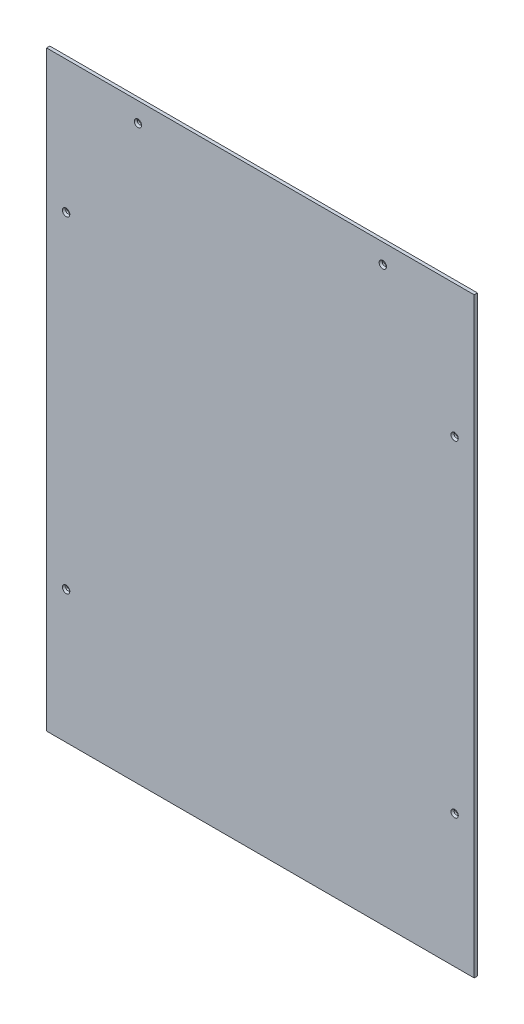
from build123d import *

# Parameters (mm, degrees)
ESQUISSE1_W             = 524
ESQUISSE1_H             = 725
BOSS_EXTRU_1_DEPTH      = 2
ESQUISSE2_R             = 2.5
ENL_V_MAT_EXTRU_1_DEPTH = 448.287659119
CHANFREIN1_SIZE         = 2


with BuildPart() as part:
    # Esquisse1 → Boss.-Extru.1 (new, symmetric)
    with BuildSketch(Plane.XY):
        Rectangle(ESQUISSE1_W, ESQUISSE1_H)
    extrude(amount=BOSS_EXTRU_1_DEPTH, both=True)

    # Esquisse2 → Enlèv. mat.-Extru.1 (cut, through all)
    with BuildSketch(Plane.XY.offset(2)):
        with Locations((-238, -200)):
            Circle(ESQUISSE2_R)
        with Locations((-238, 200)):
            Circle(ESQUISSE2_R)
        with Locations((238, -200)):
            Circle(ESQUISSE2_R)
        with Locations((238, 200)):
            Circle(ESQUISSE2_R)
        with Locations((-150, 338.5)):
            Circle(ESQUISSE2_R)
        with Locations((150, 338.5)):
            Circle(ESQUISSE2_R)
    extrude(amount=-ENL_V_MAT_EXTRU_1_DEPTH, mode=Mode.SUBTRACT)

    # Chanfrein1
    chanfrein1_edges = [part.edges().sort_by_distance(p)[0] for p in [
        (-152.5, 338.5, 2),
        (235.5, 200, 2),
        (235.5, -200, 2),
        (-240.5, 200, 2),
        (147.5, 338.5, 2),
        (-240.5, -200, 2),
    ]]
    chamfer(chanfrein1_edges, length=CHANFREIN1_SIZE)


solid = part.part
